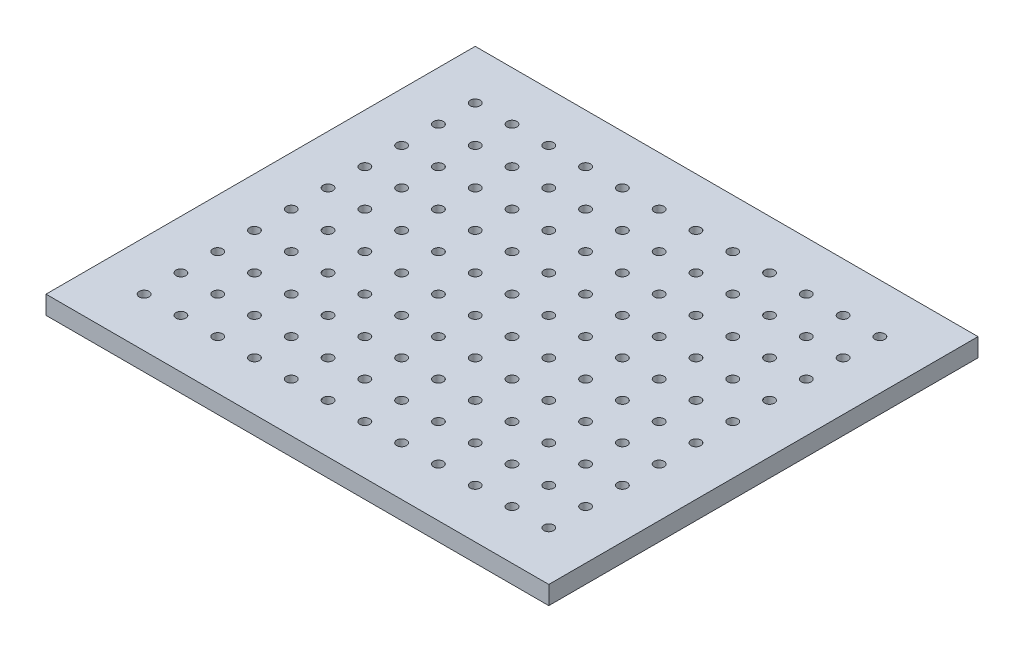
from build123d import *

# Parameters (mm, degrees)
ESBO_O1_W                 = 410
ESBO_O1_H                 = 350
RESSALTO_EXTRUS_O1_DEPTH  = 15
ESBO_O2_R                 = 4
CORTE_EXTRUS_O1_DEPTH     = 270.953699734
PADR_O_LINEAR1_COUNT      = 12
PADR_O_LINEAR1_PITCH      = 30
PADR_O_LINEAR1_COUNT_DIR2 = 10
PADR_O_LINEAR1_PITCH_DIR2 = 30


with BuildPart() as part:
    # Esboço1 → Ressalto-extrusão1 (new body)
    with BuildSketch(Plane(origin=(0, 0, 0), x_dir=(1, 0, 0), z_dir=(0, 1, 0))):
        Rectangle(ESBO_O1_W, ESBO_O1_H)
    extrude(amount=RESSALTO_EXTRUS_O1_DEPTH)

    # Esboço2 → Corte-extrusão1 (cut, through all)
    with BuildSketch(Plane(origin=(0, 15, 0), x_dir=(1, 0, 0), z_dir=(0, 1, 0))):
        with Locations(Location((-165, -135, 0), (0, 0, 270))):
            Circle(ESBO_O2_R)
    corte_extrus_o1 = extrude(amount=-CORTE_EXTRUS_O1_DEPTH, mode=Mode.SUBTRACT)

    # Padrão linear1: Corte-extrus_o1 12 × 10
    with Locations(*[(i * PADR_O_LINEAR1_PITCH, 0, -j * PADR_O_LINEAR1_PITCH_DIR2) for i in range(PADR_O_LINEAR1_COUNT) for j in range(PADR_O_LINEAR1_COUNT_DIR2) if (i, j) != (0, 0)]):
        add(corte_extrus_o1, mode=Mode.SUBTRACT)


solid = part.part
